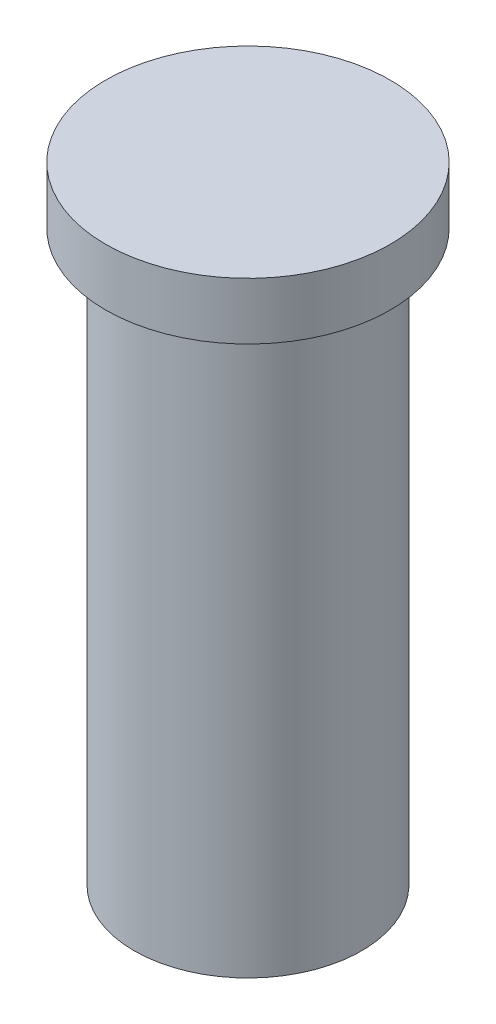
from build123d import *

# Parameters (mm, degrees)
SKETCH1_R           = 12.5
BOSS_EXTRUDE1_DEPTH = 5
SKETCH2_R           = 10
BOSS_EXTRUDE2_DEPTH = 50
SKETCH3_R           = 7.5
CUT_EXTRUDE1_DEPTH  = 50


with BuildPart() as part:
    # Sketch1 → Boss-Extrude1 (new body)
    with BuildSketch(Plane(origin=(0, 0, 0), x_dir=(1, 0, 0), z_dir=(0, 1, 0))):
        with Locations(Location((0, 0, 0), (0, 0, 270))):
            Circle(SKETCH1_R)
    extrude(amount=BOSS_EXTRUDE1_DEPTH)

    # Sketch2 → Boss-Extrude2 (add)
    with BuildSketch(Plane.XZ):
        with Locations(Location((0, 0, 0), (0, 0, 270))):
            Circle(SKETCH2_R)
    extrude(amount=BOSS_EXTRUDE2_DEPTH)

    # Sketch3 → Cut-Extrude1 (cut)
    with BuildSketch(Plane.XZ.offset(50)):
        with Locations(Location((0, 0, 0), (0, 0, 270))):
            Circle(SKETCH3_R)
    extrude(amount=-CUT_EXTRUDE1_DEPTH, mode=Mode.SUBTRACT)


solid = part.part
